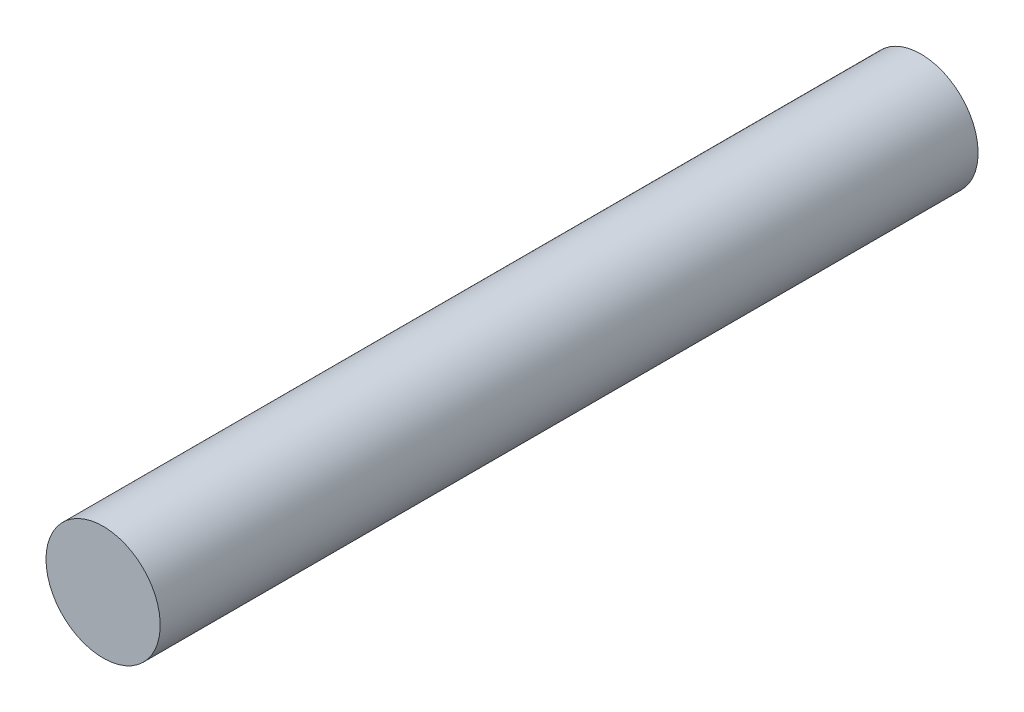
from build123d import *

# Parameters (mm, degrees)
SKETCH1_R           = 2.5
BOSS_EXTRUDE1_DEPTH = 35.8


with BuildPart() as part:
    # Sketch1 → Boss-Extrude1 (new body)
    with BuildSketch(Plane.XY):
        with Locations(Location((0, 0, 0), (0, 0, 180))):
            Circle(SKETCH1_R)
    extrude(amount=BOSS_EXTRUDE1_DEPTH)


solid = part.part
